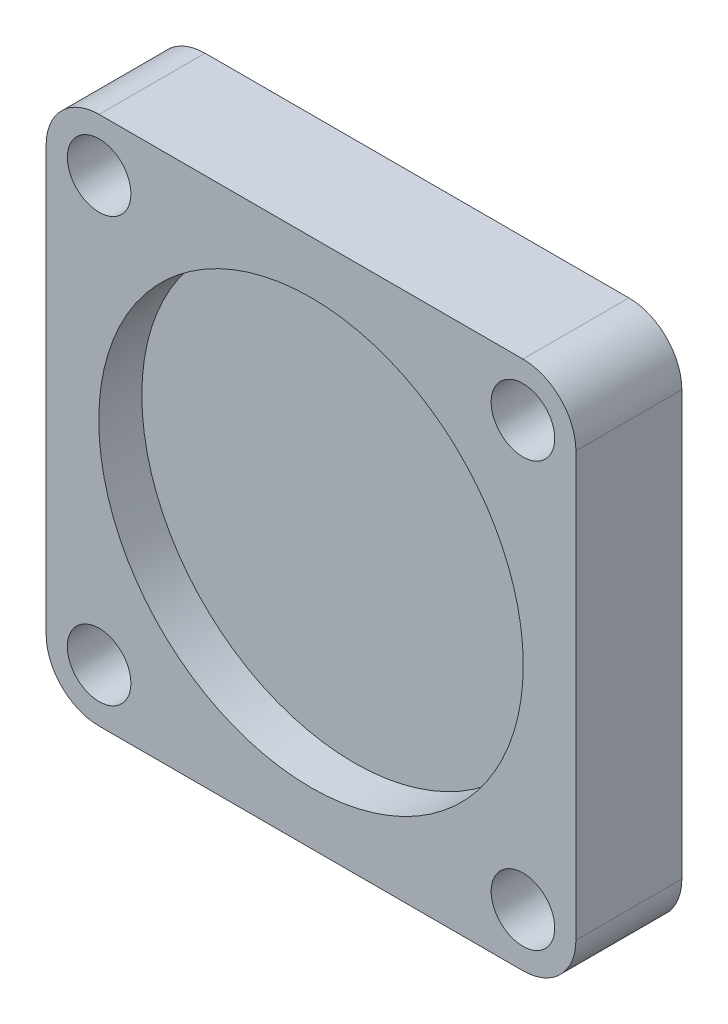
from build123d import *

# Parameters (mm, degrees)
ESQUISSE1_R             = 1.5
BOSS_EXTRU_1_DEPTH      = 5
ESQUISSE2_R             = 10.015
ENL_V_MAT_EXTRU_1_DEPTH = 2.03


with BuildPart() as part:
    # Esquisse1 → Boss.-Extru.1 (new body)
    with BuildSketch(Plane.XY):
        with BuildLine():
            Line((-10, 12.5), (10, 12.5))
            ThreePointArc((10, 12.5), (11.767766953, 11.767766953), (12.5, 10))
            Line((12.5, 10), (12.5, -10))
            ThreePointArc((12.5, -10), (11.767766953, -11.767766953), (10, -12.5))
            Line((10, -12.5), (-10, -12.5))
            ThreePointArc((-10, -12.5), (-11.767766953, -11.767766953), (-12.5, -10))
            Line((-12.5, -10), (-12.5, 10))
            ThreePointArc((-12.5, 10), (-11.767766953, 11.767766953), (-10, 12.5))
        make_face()
        with Locations((-10, 10)):
            Circle(ESQUISSE1_R, mode=Mode.SUBTRACT)
        with Locations((10, 10)):
            Circle(ESQUISSE1_R, mode=Mode.SUBTRACT)
        with Locations((10, -10)):
            Circle(ESQUISSE1_R, mode=Mode.SUBTRACT)
        with Locations((-10, -10)):
            Circle(ESQUISSE1_R, mode=Mode.SUBTRACT)
    extrude(amount=BOSS_EXTRU_1_DEPTH)

    # Esquisse2 → Enlèv. mat.-Extru.1 (cut)
    with BuildSketch(Plane.XY.offset(5)):
        Circle(ESQUISSE2_R)
    extrude(amount=-ENL_V_MAT_EXTRU_1_DEPTH, mode=Mode.SUBTRACT)


solid = part.part
